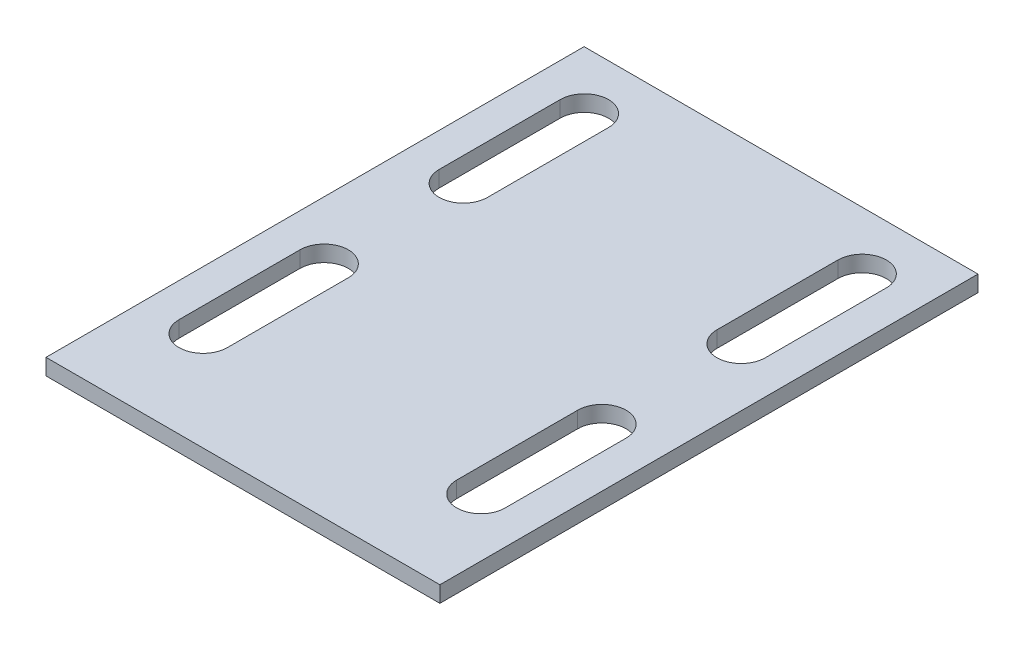
from build123d import *

# Parameters (mm, degrees)
SKETCH1_W           = 122.1
SKETCH1_H           = 197.8
BOSS_EXTRUDE2_DEPTH = 5
CUT_EXTRUDE1_DEPTH  = 5
SKETCH5_W           = 176.692600263
SKETCH5_H           = 67.834694549
CUT_EXTRUDE2_DEPTH  = 12
SKETCH6_W           = 148.50335492
SKETCH6_H           = 63.858757444
CUT_EXTRUDE3_DEPTH  = 19


with BuildPart() as part:
    # Sketch1 → Boss-Extrude2 (new body)
    with BuildSketch(Plane(origin=(0, 0, 0), x_dir=(1, 0, 0), z_dir=(0, 1, 0))):
        with Locations((61.05, 98.9)):
            Rectangle(SKETCH1_W, SKETCH1_H)
    extrude(amount=BOSS_EXTRUDE2_DEPTH)

    # Sketch3 → Cut-Extrude1 (cut)
    with BuildSketch(Plane(origin=(0, 5, 0), x_dir=(1, 0, 0), z_dir=(0, 1, 0))):
        with BuildLine():
            Line((10.5, 167.875007929), (10.5, 130.375007929))
            ThreePointArc((10.5, 130.375007929), (18, 122.875007929), (25.5, 130.375007929))
            Line((25.5, 130.375007929), (25.5, 167.875007929))
            ThreePointArc((25.5, 167.875007929), (18, 175.375007929), (10.5, 167.875007929))
        make_face()
        with BuildLine():
            ThreePointArc((111.6, 130.375007929), (104.1, 122.875007929), (96.6, 130.375007929))
            Line((96.6, 130.375007929), (96.6, 167.875007929))
            ThreePointArc((96.6, 167.875007929), (104.1, 175.375007929), (111.6, 167.875007929))
            Line((111.6, 167.875007929), (111.6, 130.375007929))
        make_face()
        with BuildLine():
            ThreePointArc((111.6, 49.721568021), (104.1, 42.221568021), (96.6, 49.721568021))
            Line((96.6, 49.721568021), (96.6, 87.221568021))
            ThreePointArc((96.6, 87.221568021), (104.1, 94.721568021), (111.6, 87.221568021))
            Line((111.6, 87.221568021), (111.6, 49.721568021))
        make_face()
        with BuildLine():
            Line((10.5, 87.221568021), (10.5, 49.721568021))
            ThreePointArc((10.5, 49.721568021), (18, 42.221568021), (25.5, 49.721568021))
            Line((25.5, 49.721568021), (25.5, 87.221568021))
            ThreePointArc((25.5, 87.221568021), (18, 94.721568021), (10.5, 87.221568021))
        make_face()
    extrude(amount=-CUT_EXTRUDE1_DEPTH, mode=Mode.SUBTRACT)

    # Sketch5 → Cut-Extrude2 (cut)
    with BuildSketch(Plane(origin=(0, 0, -197.8), x_dir=(-1, 0, 0), z_dir=(0, 0, -1))):
        with Locations((-46.708276043, -7.602787765)):
            Rectangle(SKETCH5_W, SKETCH5_H)
    extrude(amount=-CUT_EXTRUDE2_DEPTH, mode=Mode.SUBTRACT)

    # Sketch6 → Cut-Extrude3 (cut)
    with BuildSketch(Plane.XY):
        with Locations((68.056552209, 0.930489014)):
            Rectangle(SKETCH6_W, SKETCH6_H)
    extrude(amount=-CUT_EXTRUDE3_DEPTH, mode=Mode.SUBTRACT)


solid = part.part
